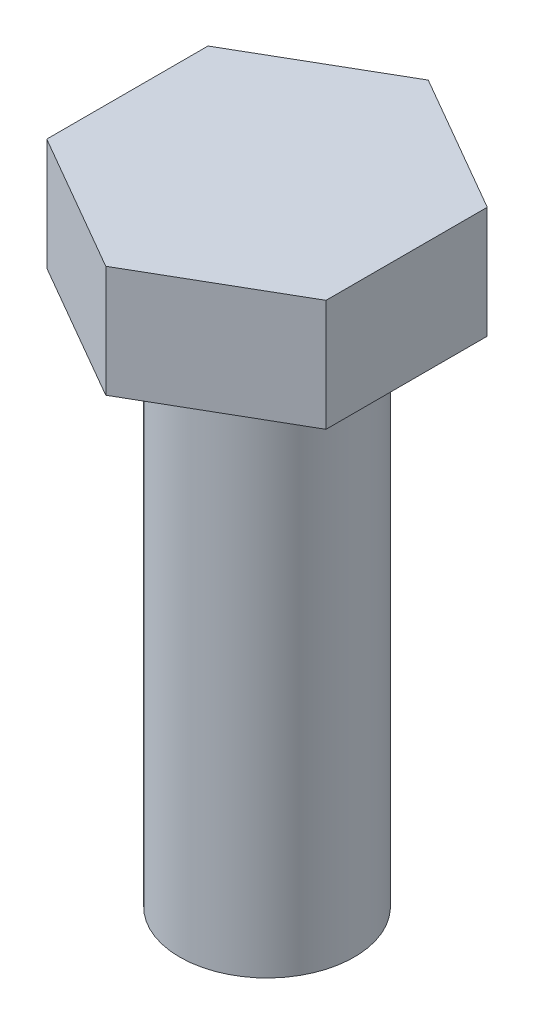
from build123d import *

# Parameters (mm, degrees)
BOSS_EXTRUDE1_DEPTH = 6.4
SKETCH2_R           = 5
BOSS_EXTRUDE2_DEPTH = 30


with BuildPart() as part:
    # Sketch1 → Boss-Extrude1 (new body)
    with BuildSketch(Plane(origin=(0, 0, 0), x_dir=(1, 0, 0), z_dir=(0, 1, 0))):
        Polygon((0, 9.237604307), (-8, 4.618802154), (-8, -4.618802154), (0, -9.237604307), (8, -4.618802154), (8, 4.618802154), align=None)
    extrude(amount=BOSS_EXTRUDE1_DEPTH)

    # Sketch2 → Boss-Extrude2 (add)
    with BuildSketch(Plane(origin=(0, 0, 0), x_dir=(1, 0, 0), z_dir=(0, 1, 0))):
        with Locations(Location((0, 0, 0), (0, 0, 270))):
            Circle(SKETCH2_R)
    extrude(amount=-BOSS_EXTRUDE2_DEPTH)


solid = part.part
